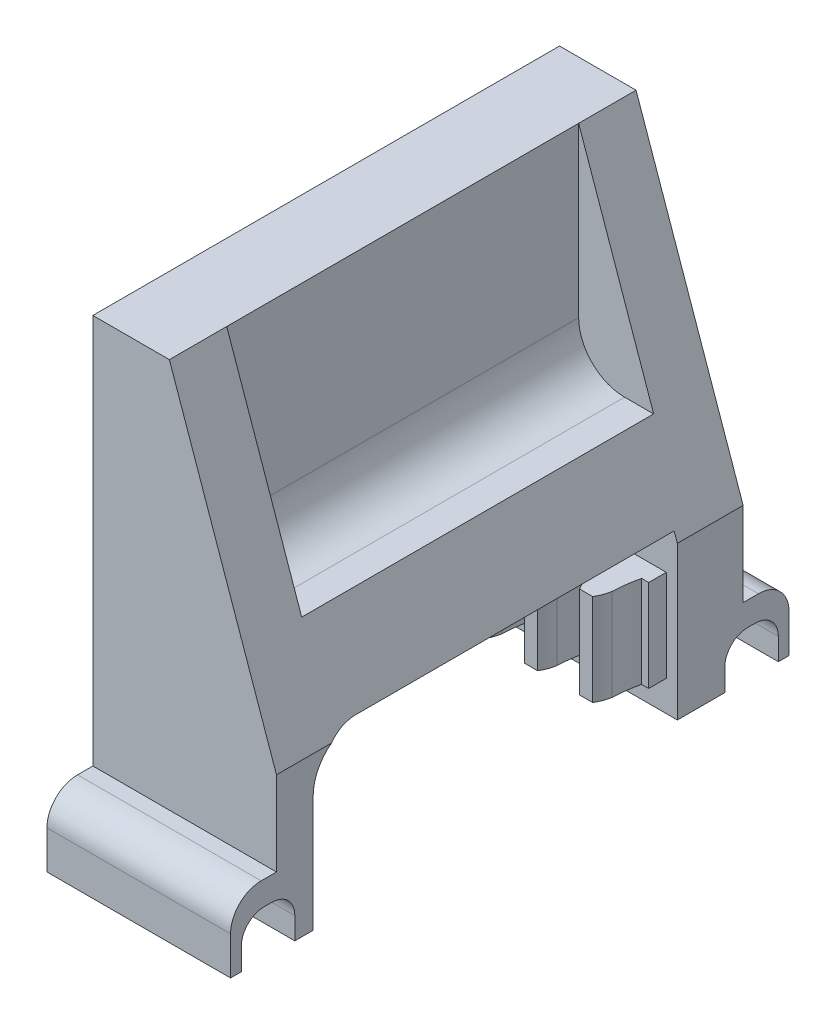
from build123d import *

# Parameters (mm, degrees)
BOSS_EXTRUDE1_DEPTH = 30.5
SKETCH4_W           = 23.8
SKETCH4_H           = 13
CUT_EXTRUDE2_DEPTH  = 25
CUT_EXTRUDE4_DEPTH  = 11.5
SKETCH7_W           = 31
SKETCH7_H           = 1.7
BOSS_EXTRUDE3_DEPTH = 6
BOSS_EXTRUDE4_DEPTH = 6
LPATTERN1_COUNT     = 8
LPATTERN1_PITCH     = 3.6
SKETCH11_W          = 12
SKETCH11_H          = 4.5
BOSS_EXTRUDE5_DEPTH = 3
FILLET1_R           = 2
FILLET2_R           = 2
FILLET5_R           = 3
SKETCH12_W          = 3.5
SKETCH12_H          = 3.5
CUT_EXTRUDE5_DEPTH  = 12
FILLET6_R           = 1.5


with BuildPart() as part:
    # Sketch1 → Boss-Extrude1 (new body)
    with BuildSketch(Plane.XY):
        Polygon((0, 0), (0, -30), (12, -30), (12, -20), (5, 0), align=None)
    extrude(amount=-BOSS_EXTRUDE1_DEPTH)

    # Sketch4 → Cut-Extrude2 (cut)
    with BuildSketch(Plane.ZY):
        with Locations((-14.3, -25.899949695)):
            Rectangle(SKETCH4_W, SKETCH4_H)
    extrude(amount=-CUT_EXTRUDE2_DEPTH, mode=Mode.SUBTRACT)

    # Sketch6 → Cut-Extrude4 (cut, symmetric)
    with BuildSketch(Plane.XY.offset(-15.25)):
        Polygon((5, 0), (5, -14), (9.9, -14), align=None)
    extrude(amount=CUT_EXTRUDE4_DEPTH, both=True, mode=Mode.SUBTRACT)

    # Sketch7 → Boss-Extrude3 (add)
    with BuildSketch(Plane(origin=(0, -28, 0), x_dir=(1, 0, 0), z_dir=(0, 1, 0))):
        with Locations((-4.2231607, 25.9)):
            Rectangle(SKETCH7_W, SKETCH7_H)
    extrude(amount=BOSS_EXTRUDE3_DEPTH)

    # Sketch10 → Boss-Extrude4 (add)
    with BuildSketch(Plane(origin=(0, -28, 0), x_dir=(1, 0, 0), z_dir=(0, 1, 0))):
        with BuildLine():
            Line((10.241326694, 22.422210505), (9.381396201, 22.422210505))
            ThreePointArc((9.381396201, 22.422210505), (9.164193514, 22.864299961), (9.037168184, 23.340204006))
            ThreePointArc((9.037168184, 23.340204006), (8.964435448, 24.200407197), (8.811361447, 25.05))
            Line((8.811361447, 25.05), (10.811361447, 25.05))
            ThreePointArc((10.811361447, 25.05), (10.658287447, 24.200407197), (10.585554711, 23.340204006))
            ThreePointArc((10.585554711, 23.340204006), (10.45852938, 22.864299961), (10.241326694, 22.422210505))
        make_face()
    boss_extrude4 = extrude(amount=BOSS_EXTRUDE4_DEPTH)

    # LPattern1: Boss-Extrude4 ×8
    with Locations(*[(-i * LPATTERN1_PITCH, 0, 0) for i in range(1, LPATTERN1_COUNT)]):
        add(boss_extrude4)

    # Sketch11 → Boss-Extrude5 (add)
    with BuildSketch(Plane(origin=(0, 0, -30.5), x_dir=(-1, 0, 0), z_dir=(0, 0, -1))):
        with Locations((-6, -27.75)):
            Rectangle(SKETCH11_W, SKETCH11_H)
    boss_extrude5 = extrude(amount=BOSS_EXTRUDE5_DEPTH)

    # Fillet1
    fillet1_edges = [part.edges().sort_by_distance(p)[0] for p in [
        (6, -25.5, -33.5),
    ]]
    fillet(fillet1_edges, radius=FILLET1_R)

    # Mirror1: Boss-Extrude5 across plane
    add(boss_extrude5.mirror(Plane.XY.offset(-15.25)))

    # Fillet2
    fillet2_edges = [part.edges().sort_by_distance(p)[0] for p in [
        (6, -25.5, 3),
    ]]
    fillet(fillet2_edges, radius=FILLET2_R)

    # Fillet5
    fillet5_edges = [part.edges().sort_by_distance(p)[0] for p in [
        (5, -14, -15.25),
        (5.894991197, -19.399949695, -2.4),
    ]]
    fillet(fillet5_edges, radius=FILLET5_R)

    # Sketch12 → Cut-Extrude5 (cut)
    with BuildSketch(Plane.ZY):
        with Locations((-31.05, -28.814354386)):
            Rectangle(SKETCH12_W, SKETCH12_H)
        with Locations((0.55, -28.814354386)):
            Rectangle(SKETCH12_W, SKETCH12_H)
    extrude(amount=-CUT_EXTRUDE5_DEPTH, mode=Mode.SUBTRACT)

    # Fillet6
    fillet6_edges = [part.edges().sort_by_distance(p)[0] for p in [
        (6, -27.064354386, -29.3),
        (6, -27.064354386, -32.8),
        (6, -27.064354386, -1.2),
        (6, -27.064354386, 2.3),
    ]]
    fillet(fillet6_edges, radius=FILLET6_R)


solid = part.part
